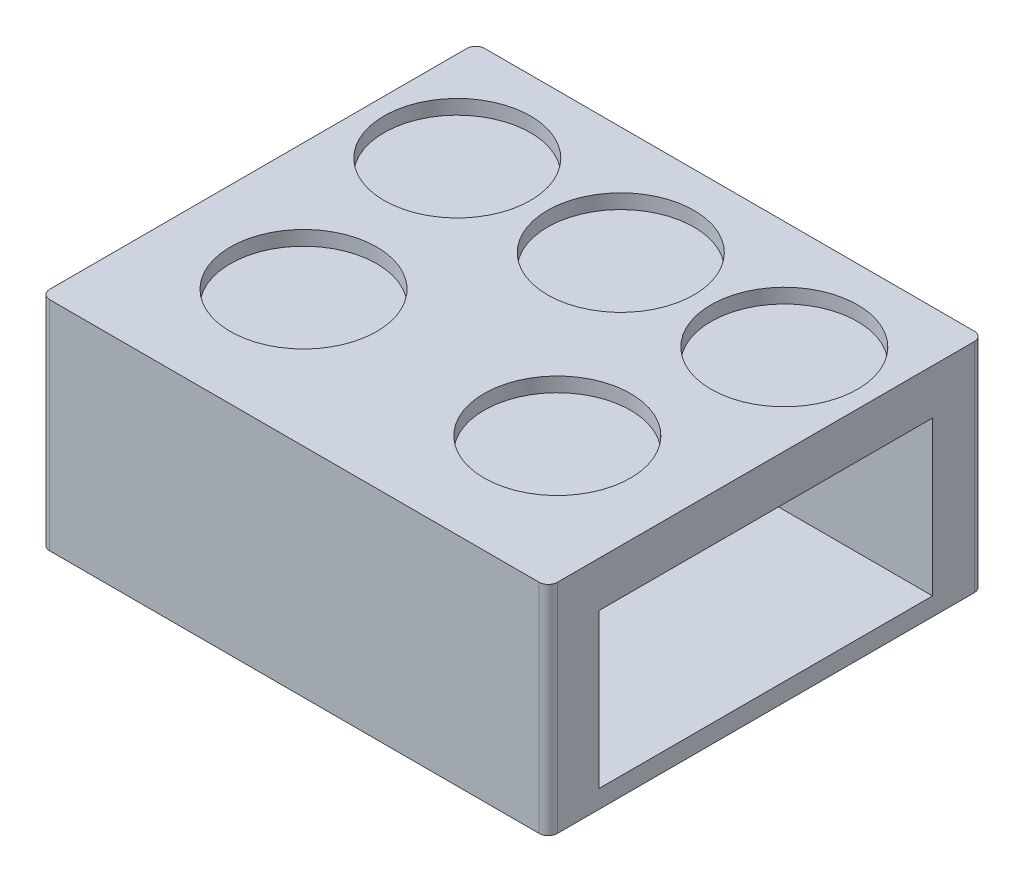
from build123d import *

# Parameters (mm, degrees)
BOSS_EXTRUDE1_DEPTH = 120
SKETCH2_W           = 184
SKETCH2_H           = 85
CUT_EXTRUDE1_DEPTH  = 370
SKETCH3_R           = 40.4
CUT_EXTRUDE2_DEPTH  = 8


with BuildPart() as part:
    # Sketch1 → Boss-Extrude1 (new body)
    with BuildSketch(Plane(origin=(0, 0, 0), x_dir=(1, 0, 0), z_dir=(0, 1, 0))):
        with BuildLine():
            Line((0, 120), (-135, 120))
            ThreePointArc((-135, 120), (-138.535533906, 118.535533906), (-140, 115))
            Line((-140, 115), (-140, -115))
            ThreePointArc((-140, -115), (-138.535533906, -118.535533906), (-135, -120))
            Line((-135, -120), (135, -120))
            ThreePointArc((135, -120), (138.535533906, -118.535533906), (140, -115))
            Line((140, -115), (140, 115))
            ThreePointArc((140, 115), (138.535533906, 118.535533906), (135, 120))
            Line((135, 120), (0, 120))
        make_face()
    extrude(amount=BOSS_EXTRUDE1_DEPTH)

    # Sketch2 → Cut-Extrude1 (cut)
    with BuildSketch(Plane(origin=(140, 0, 0), x_dir=(0, 0, -1), z_dir=(1, 0, 0))):
        with Locations((0, 52.5)):
            Rectangle(SKETCH2_W, SKETCH2_H)
    extrude(amount=-CUT_EXTRUDE1_DEPTH, mode=Mode.SUBTRACT)

    # Sketch3 → Cut-Extrude2 (cut)
    with BuildSketch(Plane(origin=(0, 120, 0), x_dir=(1, 0, 0), z_dir=(0, 1, 0))):
        with Locations(Location((70, -45, 0), (0, 0, 270))):
            Circle(SKETCH3_R)
        with Locations(Location((-70, -45, 0), (0, 0, 90))):
            Circle(SKETCH3_R)
        with Locations(Location((0, 60, 0), (0, 0, 270))):
            Circle(SKETCH3_R)
        with Locations(Location((-90.2, 60, 0), (0, 0, 270))):
            Circle(SKETCH3_R)
        with Locations(Location((90.2, 60, 0), (0, 0, 270))):
            Circle(SKETCH3_R)
    extrude(amount=-CUT_EXTRUDE2_DEPTH, mode=Mode.SUBTRACT)


solid = part.part
